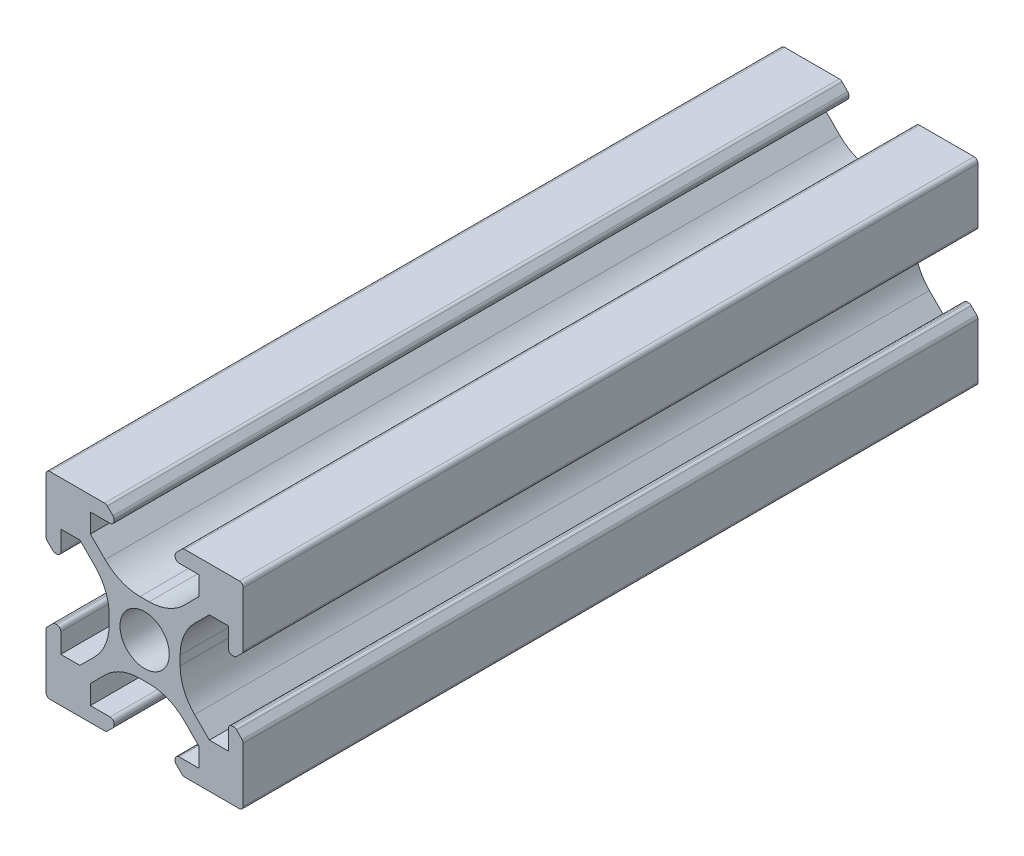
from build123d import *

# Parameters (mm, degrees)
RESSALTO_EXTRUS_O1_DEPTH = 74.5
PADR_OCIRCULAR1_COUNT    = 4
FILETE1_R                = 0.4


with BuildPart() as part:
    # Esboço1 → Ressalto-extrusão1 (new body)
    with BuildSketch(Plane.XY):
        with BuildLine():
            ThreePointArc((-9.317157288, 3.217157288), (-9.187387948, 3.130448187), (-9.034314575, 3.1))
            Line((-9.034314575, 3.1), (-8.9, 3.1))
            ThreePointArc((-8.9, 3.1), (-8.617157288, 3.217157288), (-8.5, 3.5))
            Line((-8.5, 3.5), (-8.5, 5.5))
            Line((-8.5, 5.5), (-6.560660172, 5.5))
            Line((-6.560660172, 5.5), (-5.064466094, 4.003805922))
            ThreePointArc((-5.064466094, 4.003805922), (-3.980602337, 2.381689178), (-3.6, 0.468272016))
            Line((-3.6, 0.468272016), (-3.6, 0))
            Line((-3.6, 0), (-2.5, 0))
            ThreePointArc((-2.5, 0), (-1.767766953, 1.767766953), (0, 2.5))
            Line((0, 2.5), (0, 3.6))
            Line((0, 3.6), (-0.468272016, 3.6))
            ThreePointArc((-0.468272016, 3.6), (-2.381689178, 3.980602337), (-4.003805922, 5.064466094))
            Line((-4.003805922, 5.064466094), (-5.5, 6.560660172))
            Line((-5.5, 6.560660172), (-5.5, 8.5))
            Line((-5.5, 8.5), (-3.5, 8.5))
            ThreePointArc((-3.5, 8.5), (-3.217157288, 8.617157288), (-3.1, 8.9))
            Line((-3.1, 8.9), (-3.1, 9.034314575))
            ThreePointArc((-3.1, 9.034314575), (-3.130448187, 9.187387948), (-3.217157288, 9.317157288))
            Line((-3.217157288, 9.317157288), (-3.782842712, 9.882842712))
            ThreePointArc((-3.782842712, 9.882842712), (-3.912612052, 9.969551813), (-4.065685425, 10))
            Line((-4.065685425, 10), (-10, 10))
            Line((-10, 10), (-10, 4.065685425))
            ThreePointArc((-10, 4.065685425), (-9.969551813, 3.912612052), (-9.882842712, 3.782842712))
            Line((-9.882842712, 3.782842712), (-9.317157288, 3.217157288))
        make_face()
    ressalto_extrus_o1 = extrude(amount=RESSALTO_EXTRUS_O1_DEPTH)

    # PadrãoCircular1: Ressalto-extrusão1 ×4 about axis
    padr_ocircular1_axis = Axis((0, 0, 0), (0, 0, 1))
    for i in range(1, PADR_OCIRCULAR1_COUNT):
        add(ressalto_extrus_o1.rotate(padr_ocircular1_axis, i * 360 / PADR_OCIRCULAR1_COUNT))

    # Filete1
    filete1_edges = [part.edges().sort_by_distance(p)[0] for p in [
        (10, -10, 37.25),
        (10, 10, 37.25),
        (-10, 10, 37.25),
        (-10, -10, 37.25),
    ]]
    fillet(filete1_edges, radius=FILETE1_R)


solid = part.part
